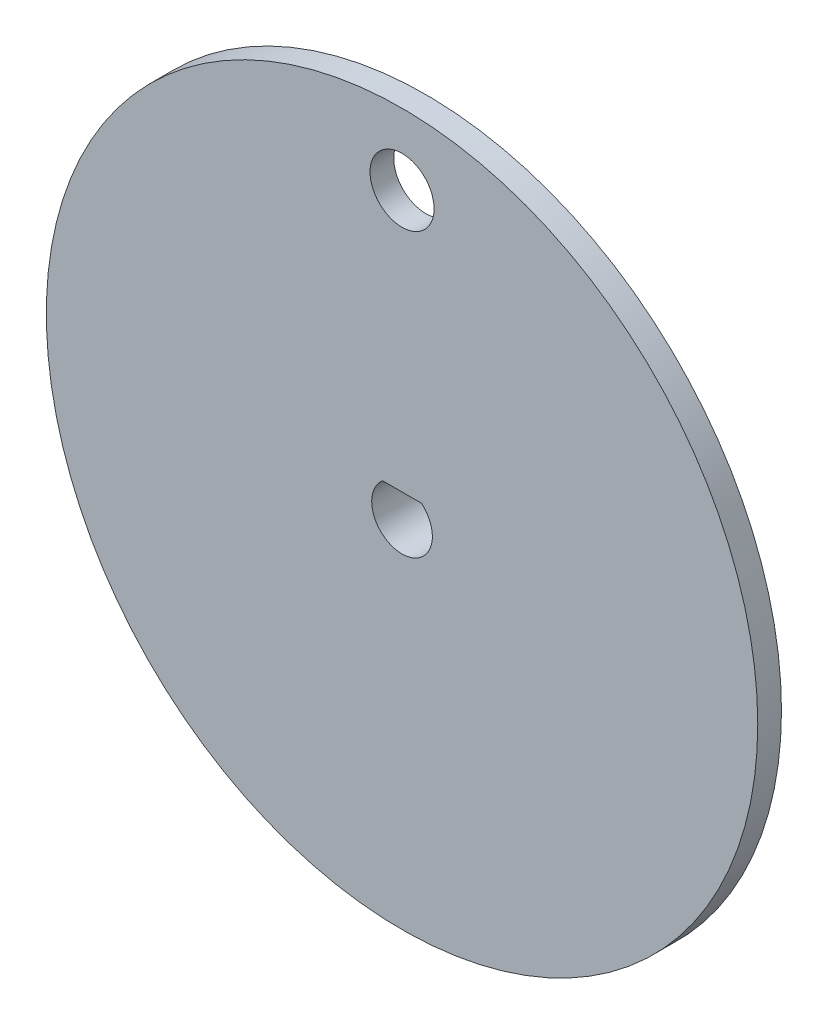
from build123d import *

# Parameters (mm, degrees)
SKETCH1_R           = 38.1
BOSS_EXTRUDE1_DEPTH = 2.54
SKETCH3_R           = 6.35
BOSS_EXTRUDE3_DEPTH = 19.05
SKETCH2_R           = 3.429
CUT_EXTRUDE1_DEPTH  = 59.046086001
CUT_EXTRUDE2_DEPTH  = 59.046086001


with BuildPart() as part:
    # Sketch1 → Boss-Extrude1 (new body)
    with BuildSketch(Plane.XY):
        Circle(SKETCH1_R)
    extrude(amount=BOSS_EXTRUDE1_DEPTH)

    # Sketch3 → Boss-Extrude3 (add)
    with BuildSketch(Plane(origin=(0, 0, 0), x_dir=(-1, 0, 0), z_dir=(0, 0, -1))):
        with Locations(Location((0, 0, 0), (0, 0, 180))):
            Circle(SKETCH3_R)
    extrude(amount=BOSS_EXTRUDE3_DEPTH)

    # Sketch2 → Cut-Extrude1 (cut, through all)
    with BuildSketch(Plane.XY.offset(2.54)):
        with Locations((0, 30.48)):
            Circle(SKETCH2_R)
    extrude(amount=-CUT_EXTRUDE1_DEPTH, mode=Mode.SUBTRACT)

    # Sketch4 → Cut-Extrude2 (cut, through all)
    with BuildSketch(Plane(origin=(0, 0, -19.05), x_dir=(-1, 0, 0), z_dir=(0, 0, -1))):
        with BuildLine():
            Line((-2.076655966, 2.5), (2.076655966, 2.5))
            ThreePointArc((2.076655966, 2.5), (0, -3.25), (-2.076655966, 2.5))
        make_face()
    extrude(amount=-CUT_EXTRUDE2_DEPTH, mode=Mode.SUBTRACT)


solid = part.part
